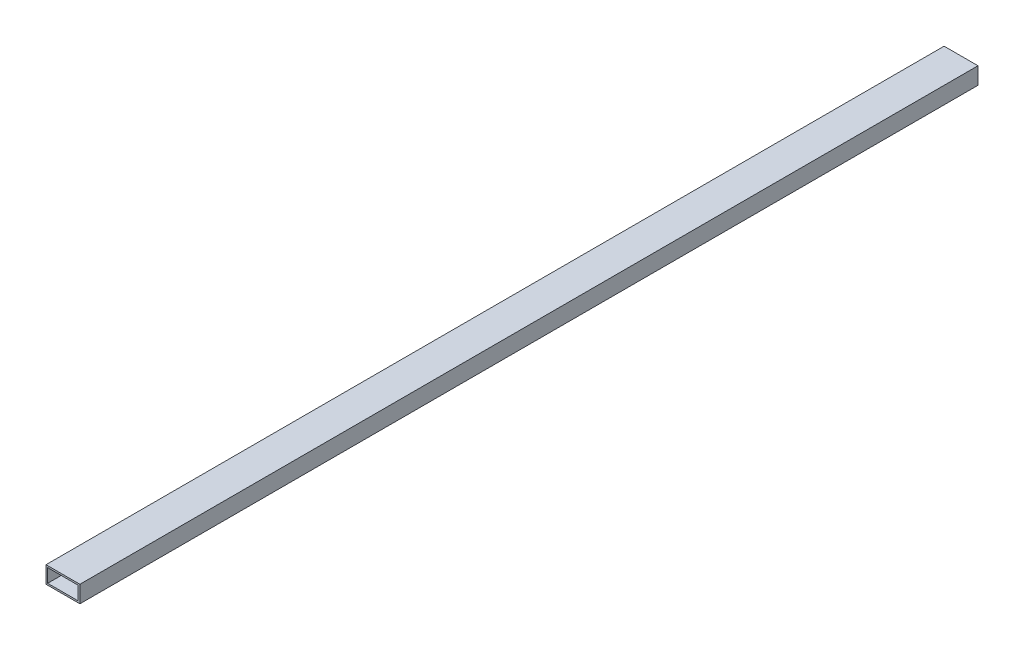
from build123d import *

# Parameters (mm, degrees)
CROQUIS1_W            = 40
CROQUIS1_H            = 20
CROQUIS1_W_2          = 36
CROQUIS1_H_2          = 16
EXTRUIR_L_MINA1_DEPTH = 1060


with BuildPart() as part:
    # Croquis1 → Extruir-Lámina1 (new body)
    with BuildSketch(Plane.XY):
        Rectangle(CROQUIS1_W, CROQUIS1_H)
        Rectangle(CROQUIS1_W_2, CROQUIS1_H_2, mode=Mode.SUBTRACT)
    extrude(amount=EXTRUIR_L_MINA1_DEPTH)


solid = part.part
